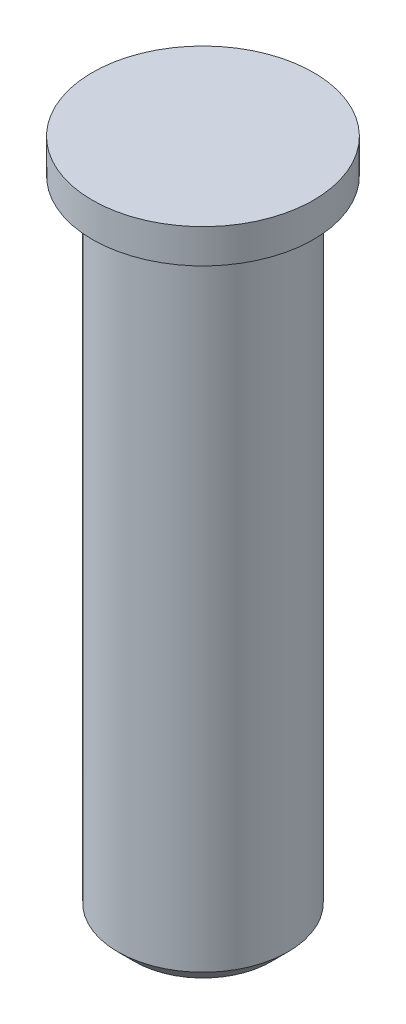
from build123d import *

# Parameters (mm, degrees)
CHAFL_N1_SIZE = 0.5


with BuildPart() as part:
    # Croquis1 → Revolución1 (revolve)
    with BuildSketch(Plane.XY, mode=Mode.PRIVATE) as revoluci_n1_sk:
        Polygon((0, 0), (3.25, 0), (3.25, -1), (2.5, -1), (2.5, -20), (0, -20), align=None)
    revolve(revoluci_n1_sk.sketch.rotate(Axis((0, 0, 0), (0, -1, 0)), 90), axis=Axis((0, 0, 0), (0, -1, 0)))

    # Chaflán1
    chafl_n1_edges = [part.edges().sort_by_distance(p)[0] for p in [
        (0, -20, -2.5),
    ]]
    chamfer(chafl_n1_edges, length=CHAFL_N1_SIZE)


solid = part.part
